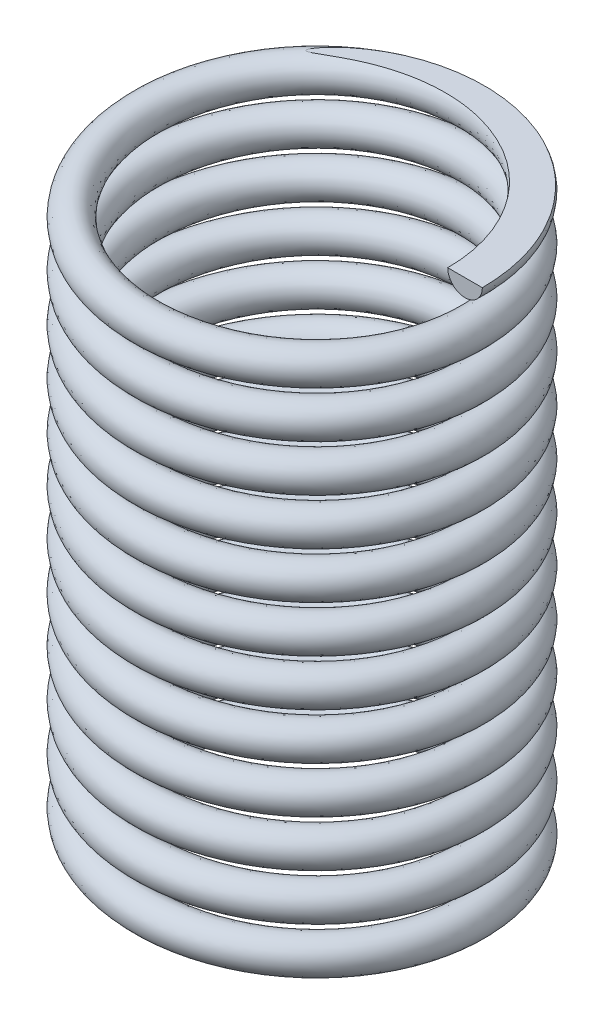
from build123d import *

# Parameters (mm, degrees)
SWEEP2_PITCH       = 18.8
SWEEP2_HEIGHT      = 235
SWEEP2_RADIUS      = 66
SWEEP2_START_ANGLE = -90
SKETCH3_R          = 7


with BuildPart() as part:
    # Sweep2: sweep along a helix
    with BuildLine() as sweep2_path:
        add(Helix(SWEEP2_PITCH, SWEEP2_HEIGHT, SWEEP2_RADIUS, center=(0, 0, 0), direction=(0, 1, 0), lefthand=True, mode=Mode.PRIVATE).rotate(Axis((0, 0, 0), (0, 1, 0)), SWEEP2_START_ANGLE))
    # Sketch3 → Sweep2 (sweep)
    with BuildSketch(Plane.XY):
        with Locations((66, 235)):
            Circle(SKETCH3_R)
    sweep(path=sweep2_path.line, is_frenet=True)

    # SurfaceCut3
    split(bisect_by=Plane(origin=(0, 235, 0), x_dir=(1, 0, 0), z_dir=(0, 1, 0)), keep=Keep.BOTTOM)

    # SurfaceCut4
    split(bisect_by=Plane(origin=(0, 0, 0), x_dir=(1, 0, 0), z_dir=(0, 1, 0)), keep=Keep.TOP)


solid = part.part
